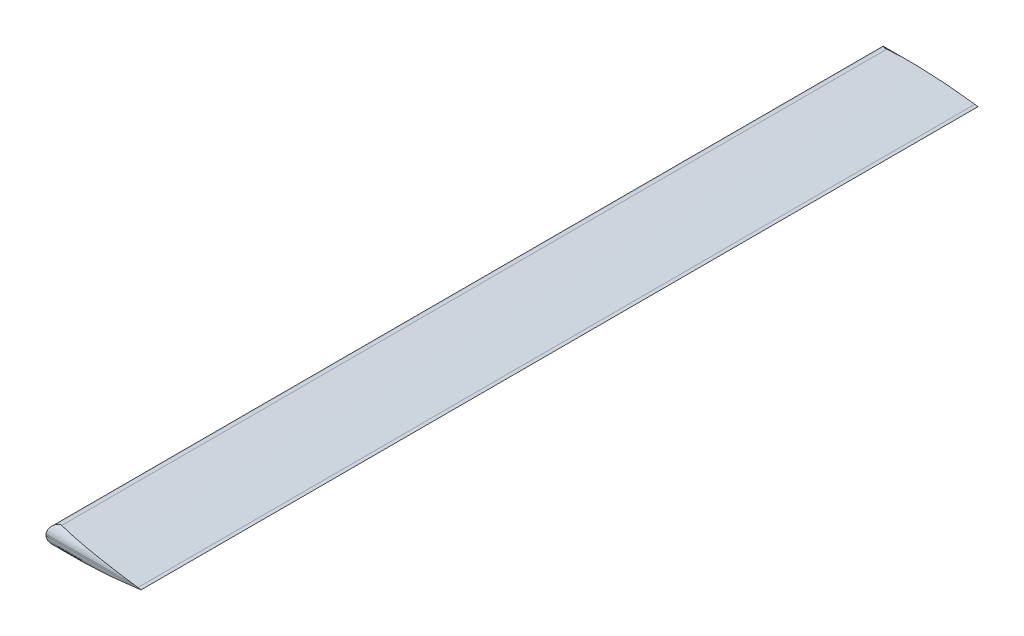
from build123d import *

# Parameters (mm, degrees)
BOSS_EXTRUDE1_DEPTH = 150
FILLET1_R           = 3
CUT_EXTRUDE1_DEPTH  = 285.8233203469566
CUT_EXTRUDE2_DEPTH  = 427.8939851607941
FILLET2_R           = 3


with BuildPart() as part:
    # Sketch2 → Boss-Extrude1 (new, symmetric)
    with BuildSketch(Plane.XY.offset(125.00000000015177)):
        with BuildLine():
            Line((72.89846834532524, 242.69830320778783), (74.06674661149295, 242.85956834580026))
            Line((74.06674661149295, 242.85956834580026), (72.89846099315261, 243.02090245472002))
            add(Edge.make_bspline(
                [(72.89846099315261, 243.02090245472002), (68.2267638317173, 243.66603930040907), (58.87016876470256, 244.8607499362663), (48.70773097498165, 245.98489597171854), (43.22785921698294, 246.5383503156189), (42.4402498311596, 246.61676771826225)],
                knots=[0.00307384445105278, 0.00307384445105278, 0.00307384445105278, 0.00307384445105278, 0.06476278116228021, 0.12645171787350754, 0.1368047068850671, 0.1368047068850671, 0.1368047068850671, 0.1368047068850671], degree=3))
            ThreePointArc((42.4402498311596, 246.61676771826225), (39.97264304578519, 242.85960813067234), (42.44026349377777, 239.10245751637794))
            add(Edge.make_bspline(
                [(42.44026349377777, 239.10245751637794), (43.22787213427322, 239.1808745211261), (48.707739087798934, 239.73434031341185), (58.87008289920574, 240.85879118424268), (68.22673649366519, 242.05335004194652), (72.89846834532524, 242.69830320778783)],
                knots=[0.8563659800158276, 0.8563659800158276, 0.8563659800158276, 0.8563659800158276, 0.8667189584082359, 0.9284078951194632, 0.9900968318306906, 0.9900968318306906, 0.9900968318306906, 0.9900968318306906], degree=3))
        make_face()
    extrude(amount=BOSS_EXTRUDE1_DEPTH, both=True)

    # Fillet1
    fillet1_edges = [part.edges().sort_by_distance(p)[0] for p in [
        (42.440263493803634, 239.10245751657357, 200.00000000015177),
        (42.44024983118546, 246.61676771845788, 50.00000000015177),
    ]]
    fillet(fillet1_edges, radius=FILLET1_R)

    # Sketch3 → Cut-Extrude1 (cut, through all)
    with BuildSketch(Plane.XZ.offset(-242.85956834594708)):
        Polygon((24.30342699368427, 205.0000000000205), (59.303426993684276, 205.0000000000205), (59.303426993684276, 185.00000000002052), (24.303426993684273, 185.00000000002052), align=None)
        Polygon((59.303426993684276, 45.00000000033732), (59.303426993684276, 65.00000000033731), (24.303426993684273, 65.00000000033731), (24.30342699368427, 45.00000000033732), align=None)
    extrude(amount=CUT_EXTRUDE1_DEPTH, mode=Mode.SUBTRACT)

    # Sketch5 → Cut-Extrude2 (cut, through all)
    with BuildSketch(Plane.ZY.offset(140.0326126689621)):
        with BuildLine():
            Line((271.0000000000222, 246.92301628433336), (277.00000000015524, 246.92301628433336))
            Line((277.00000000015524, 246.92301628433336), (277.00000000015524, 238.79621580288054))
            Line((277.00000000015524, 238.79621580288054), (271.00000000000784, 238.79621580287346))
            add(Edge.make_bspline(
                [(271.00000000000784, 238.79621580287346), (271.2768515700663, 238.79621580287295), (271.5524222221382, 238.82214739019375), (272.07557534178704, 238.91911985036535), (272.3252090783273, 238.9898684291553), (272.80009150108003, 239.17226872308322), (273.020310970727, 239.28173332217037), (273.43452421941254, 239.5375465252297), (273.62984239403096, 239.68532266793144), (273.98815024797545, 240.01675471227827), (274.15069848544283, 240.19939439931926), (274.4423042404264, 240.60407536154253), (274.5699938667296, 240.825207322677), (274.7787197274565, 241.29547550346507), (274.86166288704743, 241.55018402450142), (274.9717099396904, 242.0727462083984), (275.0000000000137, 242.34116648863198), (275.0000000000141, 242.61730737644504)],
                knots=[0, 0, 0, 0, 0.125, 0.125, 0.25, 0.25, 0.375, 0.375, 0.5, 0.5, 0.625, 0.625, 0.75, 0.75, 0.875, 0.875, 1, 1, 1, 1], degree=3))
            Line((275.0000000000141, 242.61730737644504), (275.000000000015, 243.10193373910545))
            add(Edge.make_bspline(
                [(275.000000000015, 243.10193373910545), (275.0000000000155, 243.3783593521369), (274.9708635577261, 243.65251145767596), (274.8877458129833, 244.04416820921998), (274.85347080744987, 244.1721350076453), (274.7719788239815, 244.42307272117728), (274.7244847287857, 244.5464689668092), (274.56667520049297, 244.9004506588014), (274.44046246320715, 245.11807190505783), (274.14896923163394, 245.5218866008372), (273.9837916869643, 245.70696025858962), (273.4482418453128, 246.2009861506934), (273.0279346778297, 246.46021017724968), (272.32188179741496, 246.7302571874531), (272.068140378762, 246.80191981834005), (271.54599430456585, 246.89783606726374), (271.27752491584016, 246.92301628433285), (271.0000000000222, 246.92301628433336)],
                knots=[0, 0, 0, 0, 0.12499999999999667, 0.12499999999999667, 0.18750000000000022, 0.18750000000000022, 0.2500000000000038, 0.2500000000000038, 0.37500000000001066, 0.37500000000001066, 0.5000000000000178, 0.5000000000000178, 0.7500000000000087, 0.7500000000000087, 0.8750000000000043, 0.8750000000000043, 1, 1, 1, 1], degree=3))
        make_face()
        with BuildLine():
            Line((-20.999999999987555, 246.92301628234185), (-26.999999999844587, 246.92301628233477))
            Line((-26.999999999844587, 246.92301628233477), (-26.999999999844587, 238.79621580088195))
            Line((-26.999999999844587, 238.79621580088195), (-21.000000000001915, 238.79621580088192))
            add(Edge.make_bspline(
                [(-24.99999999999565, 242.61730737446769), (-24.999999999996135, 242.34116648665463), (-24.971709939673794, 242.07274620642093), (-24.861662887032633, 241.55018402252358), (-24.778719727442613, 241.29547550148695), (-24.569993866717265, 240.8252073206981), (-24.44230424041475, 240.60407535956318), (-24.150698485432567, 240.19939439733886), (-23.98815024796577, 240.0167547102973), (-23.629842394022333, 239.68532266594923), (-23.43452421940441, 239.53754652324676), (-23.020310970719617, 239.28173332018602), (-22.800091501072984, 239.17226872109805), (-22.32520907832082, 238.9898684271685), (-22.075575341780763, 238.91911984837762), (-21.552422222132183, 238.82214738820417), (-21.276851570060362, 238.7962158008824), (-21.000000000001915, 238.79621580088192)],
                knots=[0, 0, 0, 0, 0.1250000000000001, 0.1250000000000001, 0.2500000000000002, 0.2500000000000002, 0.3750000000000002, 0.3750000000000002, 0.5000000000000001, 0.5000000000000001, 0.6250000000000001, 0.6250000000000001, 0.7500000000000001, 0.7500000000000001, 0.8750000000000001, 0.8750000000000001, 1, 1, 1, 1], degree=3))
            Line((-24.99999999999565, 242.61730737446769), (-24.9999999999948, 243.10193373712806))
            add(Edge.make_bspline(
                [(-20.999999999987555, 246.92301628234185), (-21.277524915805483, 246.92301628234233), (-21.545994304531245, 246.89783606527416), (-22.0681403787278, 246.8019198163523), (-22.321881797381053, 246.73025718546626), (-23.027934677796893, 246.46021017526533), (-23.44824184528103, 246.20098614871057), (-23.983791686934453, 245.70696025660868), (-24.148969231604838, 245.52188659885684), (-24.44046246317953, 245.1180719030785), (-24.566675200466236, 244.9004506568225), (-24.72448472876021, 244.54646896483084), (-24.771978823956537, 244.42307271919913), (-24.853470807425797, 244.17213500566743), (-24.88774581295972, 244.04416820724222), (-24.970863557703943, 243.6525114556985), (-24.999999999994305, 243.37835935015954), (-24.9999999999948, 243.10193373712806)],
                knots=[0, 0, 0, 0, 0.12499999999999534, 0.12499999999999534, 0.24999999999999067, 0.24999999999999067, 0.49999999999998157, 0.49999999999998157, 0.6249999999999887, 0.6249999999999887, 0.7499999999999957, 0.7499999999999957, 0.8124999999999992, 0.8124999999999992, 0.875000000000003, 0.875000000000003, 1, 1, 1, 1], degree=3))
        make_face()
    extrude(amount=-CUT_EXTRUDE2_DEPTH, mode=Mode.SUBTRACT)

    # Fillet2
    fillet2_edges = [part.edges().sort_by_distance(p)[0] for p in [
        (59.30342699366794, 241.9049818327161, 184.9999999999935),
        (59.30342699366794, 241.9049818327172, 204.99999999999346),
        (59.30342699366794, 241.90498183270938, 65.00000000031027),
        (59.30342699366794, 241.90498183270824, 45.00000000031028),
    ]]
    fillet(fillet2_edges, radius=FILLET2_R)


solid = part.part
